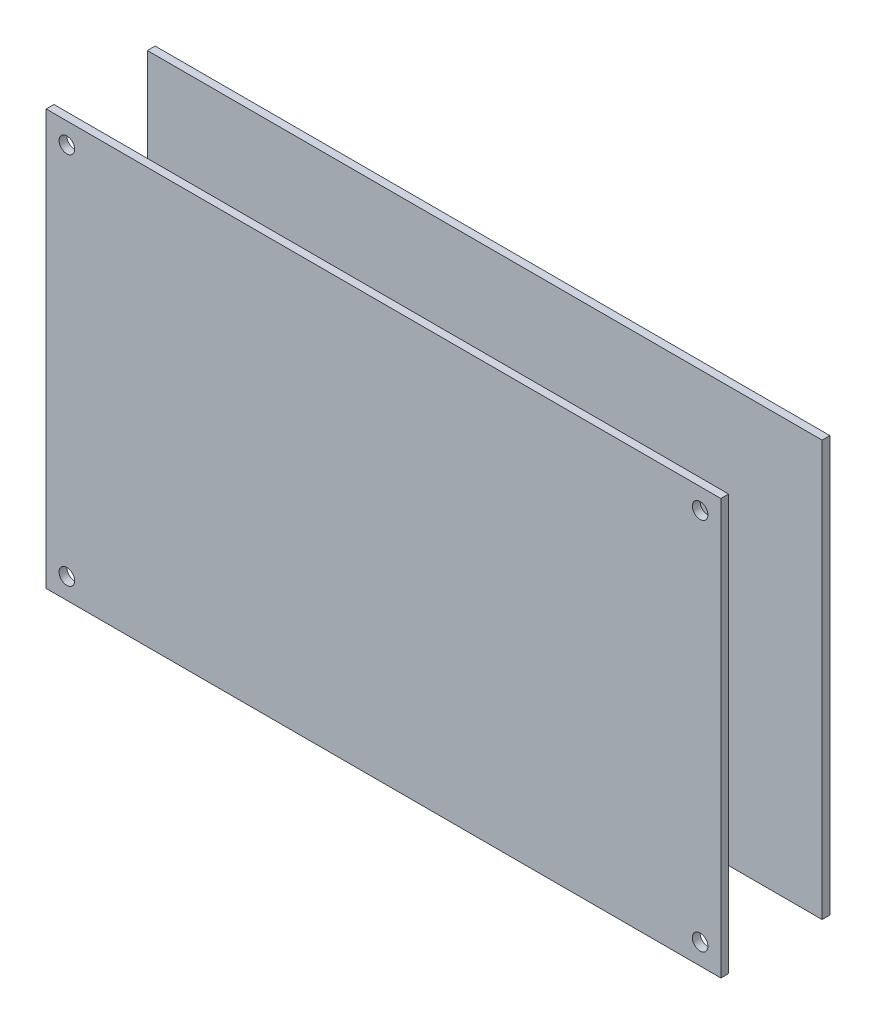
from build123d import *

# Parameters (mm, degrees)
ESQUISSE1_W             = 130
ESQUISSE1_H             = 80
BOSS_EXTRU_1_DEPTH      = 21
COQUE3_T                = -1.5
ESQUISSE2_W             = 105.5
ESQUISSE2_H             = 67.8
BOSS_EXTRU_2_DEPTH      = 5
ESQUISSE3_R             = 1.5
ENL_V_MAT_EXTRU_1_DEPTH = 10
ESQUISSE4_W             = 130
ESQUISSE4_H             = 18
ENL_V_MAT_EXTRU_2_DEPTH = 10


with BuildPart() as part:
    # Esquisse1 → Boss.-Extru.1 (new body)
    with BuildSketch(Plane.XY):
        with Locations((65, 40)):
            Rectangle(ESQUISSE1_W, ESQUISSE1_H)
    extrude(amount=BOSS_EXTRU_1_DEPTH)

    # Coque3
    coque3_openings = [part.faces().sort_by_distance(p)[0] for p in [
        (130, 40, 10.5),
        (65, 0, 10.5),
        (0, 40, 10.5),
    ]]
    offset(amount=COQUE3_T, openings=coque3_openings, kind=Kind.INTERSECTION)

    # Esquisse2 → Boss.-Extru.2 (add)
    with BuildSketch(Plane(origin=(0, 0, 0), x_dir=(-1, 0, 0), z_dir=(0, 0, -1))):
        with Locations((-64.160280936, 39.837964272)):
            Rectangle(ESQUISSE2_W, ESQUISSE2_H)
    extrude(amount=BOSS_EXTRU_2_DEPTH)

    # Esquisse3 → Enlèv. mat.-Extru.1 (cut)
    with BuildSketch(Plane.XY.offset(21)):
        with Locations((4, 76)):
            Circle(ESQUISSE3_R)
        with Locations((4, 4)):
            Circle(ESQUISSE3_R)
        with Locations((126, 76)):
            Circle(ESQUISSE3_R)
        with Locations((126, 4)):
            Circle(ESQUISSE3_R)
    extrude(amount=-ENL_V_MAT_EXTRU_1_DEPTH, mode=Mode.SUBTRACT)

    # Esquisse4 → Enlèv. mat.-Extru.2 (cut)
    with BuildSketch(Plane.XZ.offset(-78.5)):
        with Locations((65, 10.5)):
            Rectangle(ESQUISSE4_W, ESQUISSE4_H)
    extrude(amount=-ENL_V_MAT_EXTRU_2_DEPTH, mode=Mode.SUBTRACT)


with BuildPart() as enl_v_mat_extru_2_piece_1:
    # of the separate pieces the step leaves, piece 1, a body of its own (enl_v_mat_extru_2_pieces)
    add(part.part.solids().sort_by_distance((130, 80, 0))[0])


with BuildPart() as enl_v_mat_extru_2_piece_2:
    # of the separate pieces the step leaves, piece 2, a body of its own (enl_v_mat_extru_2_pieces)
    add(part.part.solids().sort_by_distance((0, 80, 19.5))[0])


solid = Compound([enl_v_mat_extru_2_piece_1.part, enl_v_mat_extru_2_piece_2.part])
